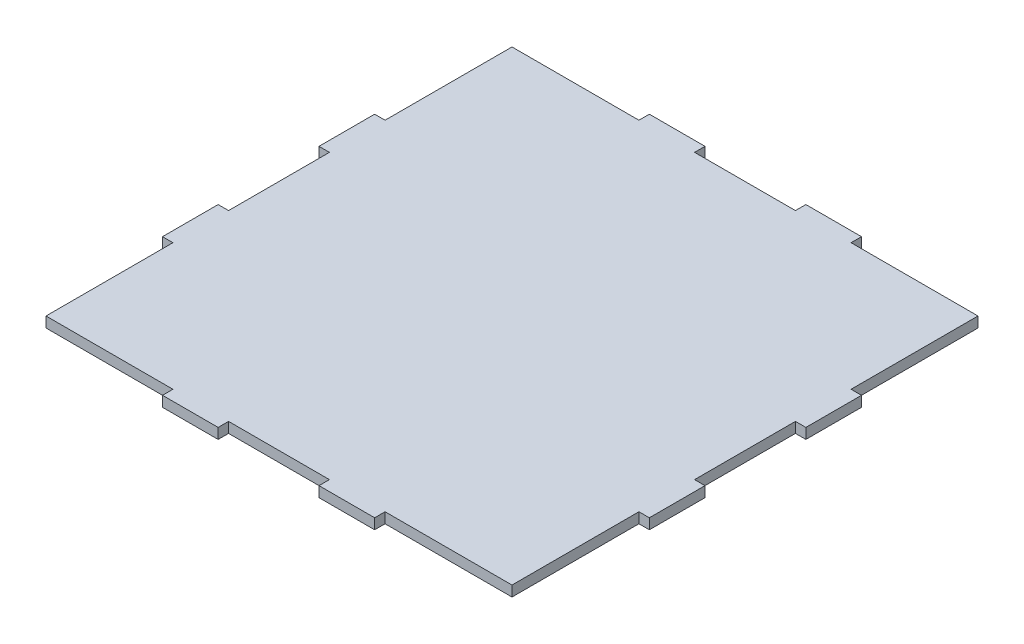
from build123d import *

# Parameters (mm, degrees)
BOSS_EXTRUDE1_DEPTH = 3
SKETCH2_W           = 3
SKETCH2_H           = 3
SKETCH2_H_2         = 36.5
SKETCH2_W_2         = 36.5
SKETCH2_W_3         = 29
SKETCH2_H_3         = 29
CUT_EXTRUDE2_DEPTH  = 3


with BuildPart() as part:
    # Sketch1 → Boss-Extrude1 (new body)
    with BuildSketch(Plane(origin=(0, 0, 0), x_dir=(1, 0, 0), z_dir=(0, 1, 0))):
        Polygon((70, 70), (-70, 70), (0, 0), align=None)
        Polygon((0, 0), (-70, 70), (-70, -70), align=None)
        Polygon((70, -70), (0, 0), (-70, -70), align=None)
        Polygon((70, 70), (0, 0), (70, -70), align=None)
    extrude(amount=BOSS_EXTRUDE1_DEPTH)

    # Sketch2 → Cut-Extrude2 (cut)
    with BuildSketch(Plane(origin=(0, 3, 0), x_dir=(1, 0, 0), z_dir=(0, 1, 0))):
        with Locations((-68.5, 68.5)):
            Rectangle(SKETCH2_W, SKETCH2_H)
        with Locations((-68.5, 48.75)):
            Rectangle(SKETCH2_W, SKETCH2_H_2)
        with Locations((-48.75, 68.5)):
            Rectangle(SKETCH2_W_2, SKETCH2_H)
        with Locations((48.75, 68.5)):
            Rectangle(SKETCH2_W_2, SKETCH2_H)
        with Locations((68.5, 68.5)):
            Rectangle(SKETCH2_W, SKETCH2_H)
        with Locations((68.5, 48.75)):
            Rectangle(SKETCH2_W, SKETCH2_H_2)
        with Locations((68.5, -68.5)):
            Rectangle(SKETCH2_W, SKETCH2_H)
        with Locations((68.5, -48.75)):
            Rectangle(SKETCH2_W, SKETCH2_H_2)
        with Locations((48.75, -68.5)):
            Rectangle(SKETCH2_W_2, SKETCH2_H)
        with Locations((-48.75, -68.5)):
            Rectangle(SKETCH2_W_2, SKETCH2_H)
        with Locations((-68.5, -68.5)):
            Rectangle(SKETCH2_W, SKETCH2_H)
        with Locations((-68.5, -48.75)):
            Rectangle(SKETCH2_W, SKETCH2_H_2)
        with Locations((0, 68.5)):
            Rectangle(SKETCH2_W_3, SKETCH2_H)
        with Locations((0, -68.5)):
            Rectangle(SKETCH2_W_3, SKETCH2_H)
        with Locations((68.5, 0)):
            Rectangle(SKETCH2_W, SKETCH2_H_3)
        with Locations((-68.5, 0)):
            Rectangle(SKETCH2_W, SKETCH2_H_3)
    extrude(amount=-CUT_EXTRUDE2_DEPTH, mode=Mode.SUBTRACT)


solid = part.part
